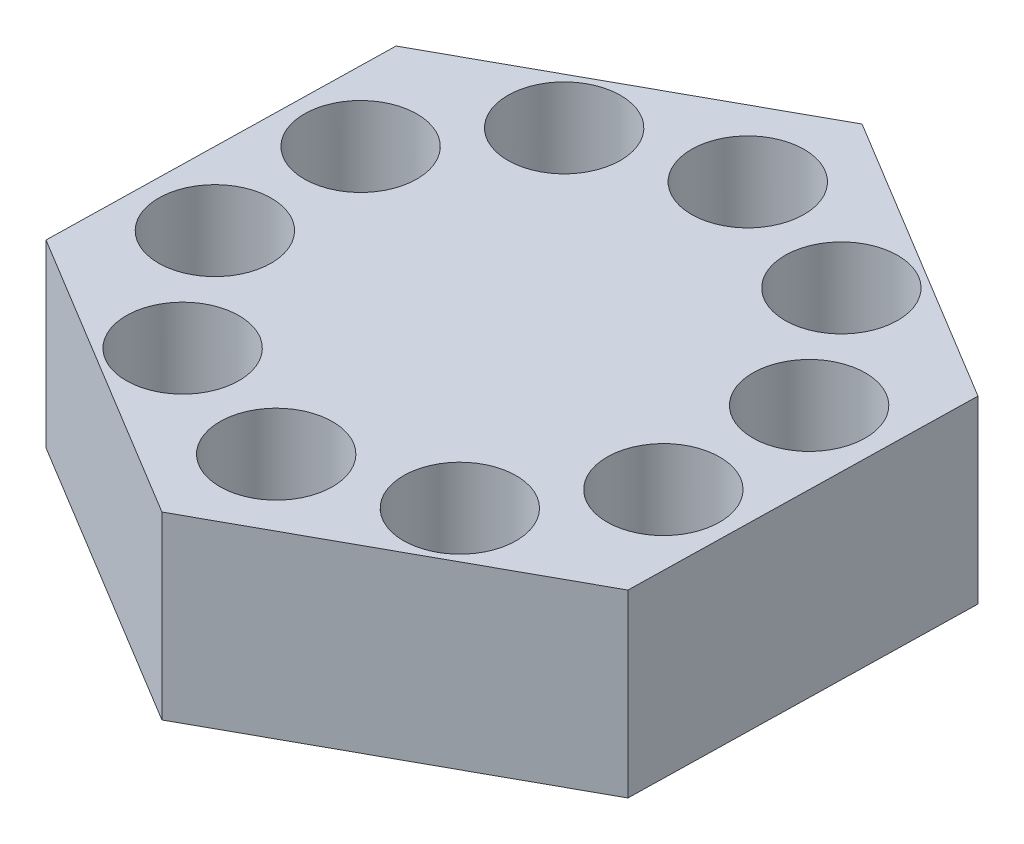
from build123d import *

# Parameters (mm, degrees)
BOSS_EXTRUDE1_DEPTH      = 27.178
BOSS_EXTRUDE1_DEPTH_BACK = 8.89
CUT_EXTRUDE1_REACH       = 100.213
SKETCH3_R                = 11.289480869
CIRPATTERN1_COUNT        = 10


with BuildPart() as part:
    # Sketch1 → Boss-Extrude1 (new, two sides: drawn at the far end of the back side and taken through both)
    with BuildSketch(Plane(origin=(0, 0, 0), x_dir=(1, 0, 0), z_dir=(0, 1, 0)).offset(-BOSS_EXTRUDE1_DEPTH_BACK)):
        Polygon((58.792489402, -35.575073205), (60.205161838, 33.128252771), (1.412672436, 68.703325976), (-58.792489402, 35.575073205), (-60.205161838, -33.128252771), (-1.412672436, -68.703325976), align=None)
    extrude(amount=BOSS_EXTRUDE1_DEPTH + BOSS_EXTRUDE1_DEPTH_BACK)

    # Sketch3 → Cut-Extrude1 (cut, up to next)
    with BuildSketch(Plane(origin=(0, 27.178, 0), x_dir=(1, 0, 0), z_dir=(0, 1, 0)), mode=Mode.PRIVATE) as cut_extrude1_sk1:
        with Locations((0, -47.225969932)):
            Circle(SKETCH3_R)
    cut_extrude1_tool1 = extrude(cut_extrude1_sk1.sketch, amount=-CUT_EXTRUDE1_REACH, mode=Mode.PRIVATE) & part.part
    cut_extrude1 = cut_extrude1_tool1.solids().sort_by_distance((0, 27.178, 47.22597))[0]
    add(cut_extrude1, mode=Mode.SUBTRACT)

    # CirPattern1: Cut-Extrude1 ×10 about axis
    cirpattern1_axis = Axis((0, 28.9814, 0), (0, -1, 0))
    for i in range(1, CIRPATTERN1_COUNT):
        add(cut_extrude1.rotate(cirpattern1_axis, i * 360 / CIRPATTERN1_COUNT), mode=Mode.SUBTRACT)


solid = part.part
